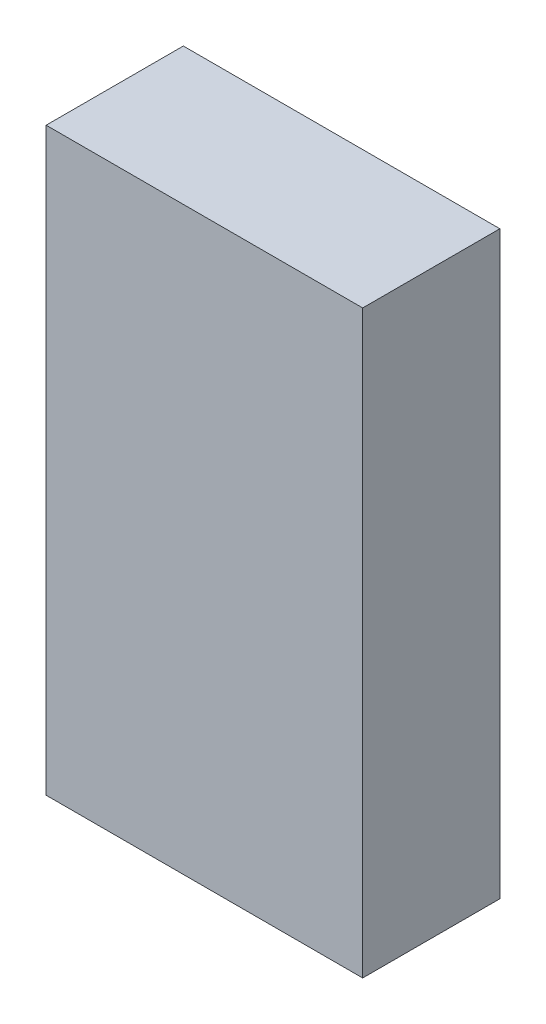
from build123d import *

# Parameters (mm, degrees)
SKETCH1_W           = 60
SKETCH1_H           = 110
BOSS_EXTRUDE1_DEPTH = 26


with BuildPart() as part:
    # Sketch1 → Boss-Extrude1 (new body)
    with BuildSketch(Plane.XY):
        with Locations((30, 55)):
            Rectangle(SKETCH1_W, SKETCH1_H)
    extrude(amount=BOSS_EXTRUDE1_DEPTH)


solid = part.part
